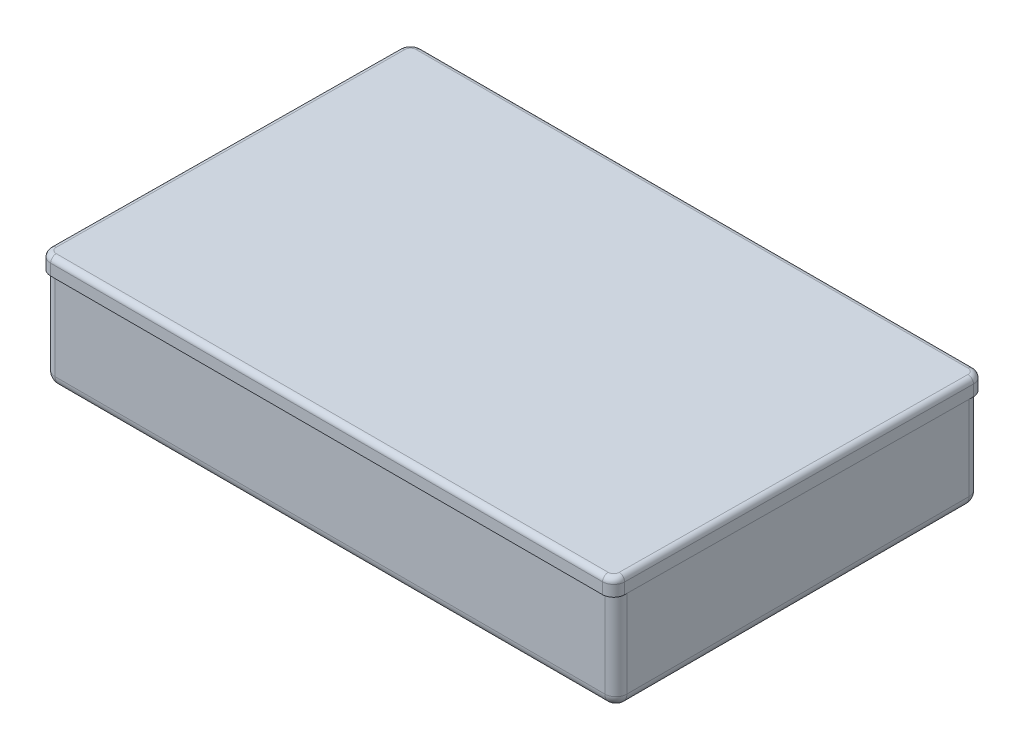
from build123d import *

# Parameters (mm, degrees)
SKETCH1_W                       = 328.93
SKETCH1_H                       = 209.55
BOSS_EXTRUDE1_DEPTH             = 57.15
FILLET1_R                       = 6.35
SHELL1_T                        = -2.54
LID_OPENING_ANGLE_CONTROL_DEPTH = 165.1
FILLET2_R                       = 6.35
FILLET3_R                       = 3.175
SHELL2_T                        = -2.54


with BuildPart() as part:
    # Sketch1 → Boss-Extrude1 (new body)
    with BuildSketch(Plane(origin=(0, 0, 0), x_dir=(1, 0, 0), z_dir=(0, 1, 0))):
        Rectangle(SKETCH1_W, SKETCH1_H)
    extrude(amount=BOSS_EXTRUDE1_DEPTH)

    # Fillet1
    fillet1_edges = [part.edges().sort_by_distance(p)[0] for p in [
        (0, 0, 104.775),
        (-164.465, 0, 0),
        (0, 0, -104.775),
        (164.465, 0, 0),
        (164.465, 28.575, 104.775),
        (-164.465, 28.575, 104.775),
        (-164.465, 28.575, -104.775),
        (164.465, 28.575, -104.775),
    ]]
    fillet(fillet1_edges, radius=FILLET1_R)

    # Shell1
    shell1_openings = [part.faces().sort_by_distance(p)[0] for p in [
        (0, 57.15, 0),
    ]]
    offset(amount=SHELL1_T, openings=shell1_openings, kind=Kind.INTERSECTION)


with BuildPart() as body_2:
    # Sketch2 → LID OPENING ANGLE CONTROL (new, symmetric)
    with BuildSketch(Plane(origin=(0, 0, 0), x_dir=(0, 0, -1), z_dir=(1, 0, 0))):
        Polygon((106.571051224, 55.353948776), (-106.780824681, 57.21584239), (-106.69770443, 66.740479707), (106.654171475, 64.878586093), align=None)
    extrude(amount=LID_OPENING_ANGLE_CONTROL_DEPTH, both=True)

    # Fillet2
    fillet2_edges = [body_2.edges().sort_by_distance(p)[0] for p in [
        (165.1, 61.978161048, 106.739264555),
        (165.1, 60.116267434, -106.61261135),
        (-165.1, 61.978161048, 106.739264555),
        (-165.1, 60.116267434, -106.61261135),
    ]]
    fillet(fillet2_edges, radius=FILLET2_R)

    # Fillet3
    fillet3_edges = [body_2.edges().sort_by_distance(p)[0] for p in [
        (165.1, 65.8095329, 0.021766478),
        (-165.1, 65.8095329, 0.021766478),
        (0, 66.740479707, 106.69770443),
        (0, 64.878586093, -106.654171475),
        (-163.240128061, 66.724249468, 104.837903309),
        (163.240128061, 66.724249468, 104.837903309),
        (-163.240128061, 64.894816331, -104.794370354),
        (163.240128061, 64.894816331, -104.794370354),
    ]]
    fillet(fillet3_edges, radius=FILLET3_R)

    # Shell2
    shell2_openings = [body_2.faces().sort_by_distance(p)[0] for p in [
        (0, 56.284895583, 0.104886728),
    ]]
    offset(amount=SHELL2_T, openings=shell2_openings, kind=Kind.INTERSECTION)


solid = Compound([part.part, body_2.part])
